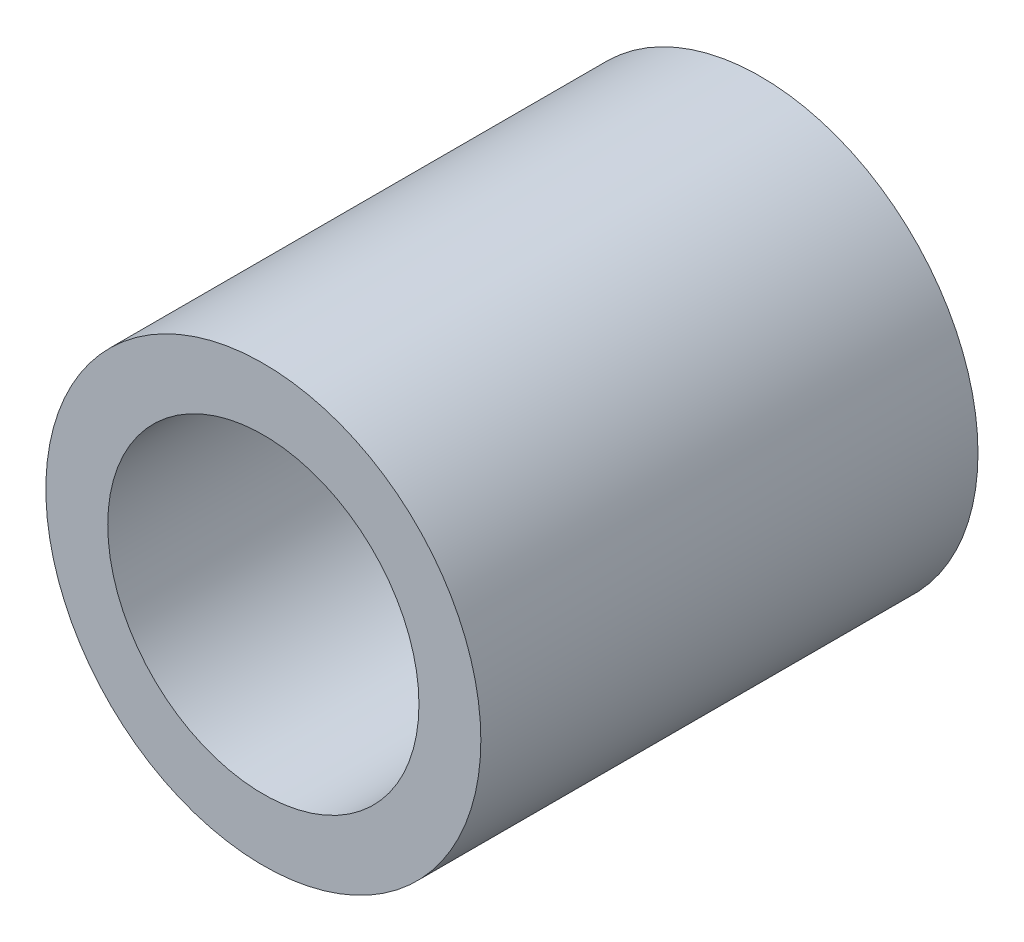
from build123d import *

# Parameters (mm, degrees)
SKETCH1_R      = 5.55625
SKETCH1_R_2    = 3.9751
EXTRUDE1_DEPTH = 6.35


with BuildPart() as part:
    # Sketch1 → Extrude1 (new, symmetric)
    with BuildSketch(Plane.XY):
        Circle(SKETCH1_R)
        Circle(SKETCH1_R_2, mode=Mode.SUBTRACT)
    extrude(amount=EXTRUDE1_DEPTH, both=True)


solid = part.part
